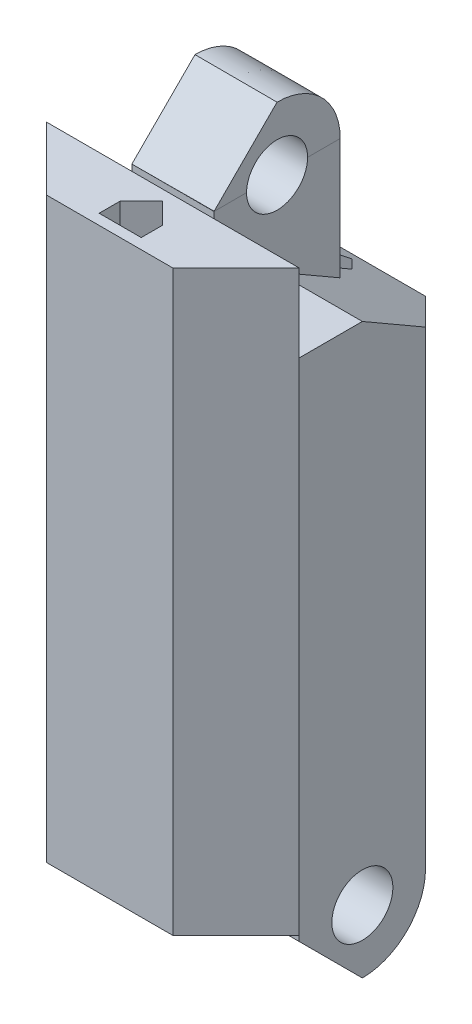
from build123d import *

# Parameters (mm, degrees)
BOSS_EXTRUDE1_DEPTH     = 10
CUT_EXTRUDE2_DEPTH      = 14.114877049
SKETCH6_W               = 3.9
SKETCH6_H               = 6
BOSS_EXTRUDE3_DEPTH     = 4
SKETCH7_W               = 3.9
SKETCH7_H               = 3
REVOLVE1_ANGLE          = 180
SKETCH9_R               = 1.45
CUT_EXTRUDE3_DEPTH      = 5
SKETCH10_W              = 3.9
SKETCH10_H              = 6
BOSS_EXTRUDE4_DEPTH     = 4
REVOLVE2_ANGLE          = 180
SKETCH14_R              = 1.45
CUT_EXTRUDE4_DEPTH      = 5
BOSS_EXTRUDE7_DEPTH     = 3.7
BOSS_EXTRUDE17_DEPTH    = 3.75
CUT_EXTRUDE6_DEPTH      = 20
CUT_EXTRUDE6_DEPTH_BACK = 20
CUT_EXTRUDE7_DEPTH      = 20.702855123
CUT_EXTRUDE7_DEPTH_BACK = 20.702855123
CUT_EXTRUDE8_DEPTH      = 22.656407828
CUT_EXTRUDE8_DEPTH_BACK = 22.656407828


with BuildPart() as part:
    # Sketch2 → Boss-Extrude1 (new, symmetric)
    with BuildSketch(Plane(origin=(0, 0, 0), x_dir=(1, 0, 0), z_dir=(0, 1, 0))):
        Polygon((-3, 6), (3, 6), (6, 3), (6, -3), (3, -6), (-3, -6), (-6, -3), (-6, 3), align=None)
    extrude(amount=BOSS_EXTRUDE1_DEPTH, both=True)

    # Sketch5 → Cut-Extrude2 (cut, symmetric)
    with BuildSketch(Plane(origin=(0, 0, 0), x_dir=(0, 0, -1), z_dir=(1, 0, 0))):
        Polygon((0, 10), (6, 6.535898385), (6, 10), align=None)
    cut_extrude2 = extrude(amount=CUT_EXTRUDE2_DEPTH, both=True, mode=Mode.SUBTRACT)

    # Mirror3: Cut-Extrude2 across plane
    add(cut_extrude2.mirror(Plane.ZX), mode=Mode.SUBTRACT)

    # Sketch6 → Boss-Extrude3 (add, symmetric)
    with BuildSketch(Plane.XZ.offset(10)):
        with Locations((-4.05, 0)):
            Rectangle(SKETCH6_W, SKETCH6_H)
    boss_extrude3 = extrude(amount=BOSS_EXTRUDE3_DEPTH, both=True)

    # Sketch7 → Revolve1 (revolve)
    with BuildSketch(Plane.XZ.offset(14)):
        with Locations((-4.05, 1.5)):
            Rectangle(SKETCH7_W, SKETCH7_H)
    revolve1 = revolve(axis=Axis((-6, -14, 0), (1, 0, 0)), revolution_arc=REVOLVE1_ANGLE)

    # Sketch9 → Cut-Extrude3 (cut, symmetric)
    with BuildSketch(Plane.ZY.offset(6)):
        with Locations((0, -14)):
            Circle(SKETCH9_R)
    cut_extrude3 = extrude(amount=CUT_EXTRUDE3_DEPTH, both=True, mode=Mode.SUBTRACT)

    # Mirror5: Boss-Extrude3, Revolve1, Cut-Extrude3 across plane
    add(boss_extrude3.mirror(Plane(origin=(0, 0, 0), x_dir=(0, 0, 1), z_dir=(1, 0, 0))))
    add(revolve1.mirror(Plane(origin=(0, 0, 0), x_dir=(0, 0, 1), z_dir=(1, 0, 0))))
    add(cut_extrude3.mirror(Plane(origin=(0, 0, 0), x_dir=(0, 0, 1), z_dir=(1, 0, 0))), mode=Mode.SUBTRACT)

    # Sketch10 → Boss-Extrude4 (add, symmetric)
    with BuildSketch(Plane(origin=(0, 10, 0), x_dir=(1, 0, 0), z_dir=(0, 1, 0))):
        Rectangle(SKETCH10_W, SKETCH10_H)
    extrude(amount=BOSS_EXTRUDE4_DEPTH, both=True)

    # Sketch12 → Revolve2 (revolve)
    with BuildSketch(Plane(origin=(0, 14, 0), x_dir=(1, 0, 0), z_dir=(0, 1, 0))):
        Polygon((-1.95, 3), (-1.95, 0), (1.95, 0.003655936), (1.95, 3), align=None)
    revolve(axis=Axis((-1.95, 14, 0), (0.9999995606226393, 0, -0.0009374190783233235)), revolution_arc=REVOLVE2_ANGLE)

    # Sketch14 → Cut-Extrude4 (cut, symmetric)
    with BuildSketch(Plane.ZY.offset(1.95)):
        with Locations((0, 14)):
            Circle(SKETCH14_R)
    extrude(amount=CUT_EXTRUDE4_DEPTH, both=True, mode=Mode.SUBTRACT)

    # Sketch17 → Boss-Extrude7 (add)
    with BuildSketch(Plane(origin=(0, 10, 0), x_dir=(1, 0, 0), z_dir=(0, 1, 0))):
        Polygon((-6, -3), (-1.95, -3), (1.95, -3), (6, -3), (3, -6), (-3, -6), align=None)
    extrude(amount=BOSS_EXTRUDE7_DEPTH)

    # Sketch19 → Boss-Extrude17 (add)
    with BuildSketch(Plane.XZ.offset(10)):
        Polygon((-6, 3), (-2.1, 3), (2.1, 3), (6, 3), (3, 6), (-3, 6), align=None)
    extrude(amount=BOSS_EXTRUDE17_DEPTH)

    # Sketch15 → Cut-Extrude6 (cut, two sides: drawn at the far end of the back side and taken through both)
    with BuildSketch(Plane(origin=(0, 0, 0), x_dir=(1, 0, 0), z_dir=(0, 1, 0)).offset(-CUT_EXTRUDE6_DEPTH_BACK)):
        Polygon((0, 5.5), (-1, 4.5), (-1, 3.5), (1, 3.5), (1, 4.5), align=None)
        Polygon((1, -4.5), (0, -3.5), (-1, -4.5), (-1, -5.5), (1, -5.5), align=None)
    extrude(amount=CUT_EXTRUDE6_DEPTH + CUT_EXTRUDE6_DEPTH_BACK, mode=Mode.SUBTRACT)

    # Sketch20 → Cut-Extrude7 (cut, two sides: drawn at the far end of the back side and taken through both)
    with BuildSketch(Plane.ZY.offset(1.95).offset(-CUT_EXTRUDE7_DEPTH_BACK)):
        Polygon((3, 14), (8.338e-05, 16.999998681), (8.6017e-05, 17.537492691), (3, 17.537492691), (3.371623525, 17.537492691), (3.371623525, 14), align=None)
    extrude(amount=CUT_EXTRUDE7_DEPTH + CUT_EXTRUDE7_DEPTH_BACK, mode=Mode.SUBTRACT)

    # Sketch21 → Cut-Extrude8 (cut, two sides: drawn at the far end of the back side and taken through both)
    with BuildSketch(Plane(origin=(6, 0, 0), x_dir=(0, 0, -1), z_dir=(1, 0, 0)).offset(-CUT_EXTRUDE8_DEPTH_BACK)):
        Polygon((-3, -14), (0, -17), (0, -17.720731205), (-3.510483934, -17.720731205), (-3.510483934, -14.510483934), (-3.510483934, -14), align=None)
    extrude(amount=CUT_EXTRUDE8_DEPTH + CUT_EXTRUDE8_DEPTH_BACK, mode=Mode.SUBTRACT)


solid = part.part
